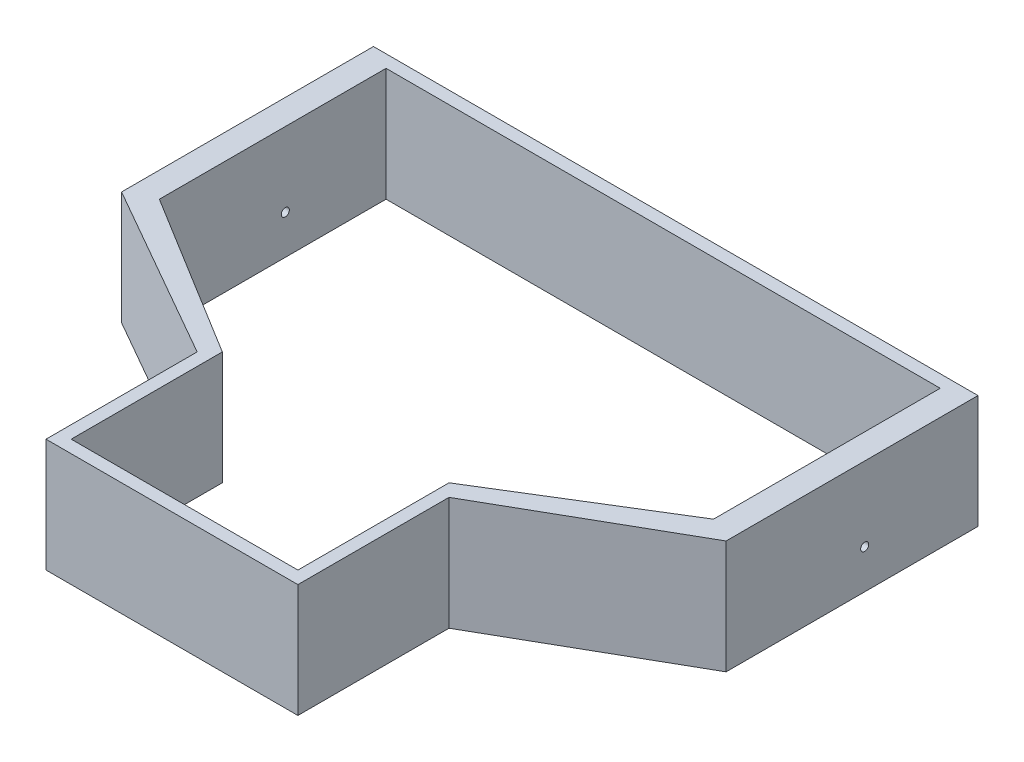
from build123d import *

# Parameters (mm, degrees)
BOSS_EXTRUDE1_DEPTH = 57.15
CUT_EXTRUDE1_DEPTH  = 57.15
SKETCH3_R           = 2.032
CUT_EXTRUDE2_DEPTH  = 401.855538193


with BuildPart() as part:
    # Sketch1 → Boss-Extrude1 (new body)
    with BuildSketch(Plane(origin=(0, 0, 0), x_dir=(1, 0, 0), z_dir=(0, 1, 0))):
        Polygon((-152.4, 0), (152.4, 0), (152.4, -127), (63.5, -177.8), (63.5, -254), (-63.5, -254), (-63.5, -177.8), (-152.4, -127), align=None)
    extrude(amount=BOSS_EXTRUDE1_DEPTH)

    # Sketch2 → Cut-Extrude1 (cut)
    with BuildSketch(Plane(origin=(0, 57.15, 0), x_dir=(1, 0, 0), z_dir=(0, 1, 0))):
        Polygon((-139.7, -6.35), (139.7, -6.35), (139.7, -120.65), (57.15, -171.45), (57.15, -247.65), (-57.15, -247.65), (-57.15, -171.45), (-139.7, -120.65), align=None)
    extrude(amount=-CUT_EXTRUDE1_DEPTH, mode=Mode.SUBTRACT)

    # Sketch3 → Cut-Extrude2 (cut, through all)
    with BuildSketch(Plane(origin=(152.4, 0, 0), x_dir=(0, 0, -1), z_dir=(1, 0, 0))):
        with Locations((-57.15, 19.685)):
            Circle(SKETCH3_R)
    extrude(amount=-CUT_EXTRUDE2_DEPTH, mode=Mode.SUBTRACT)


solid = part.part
